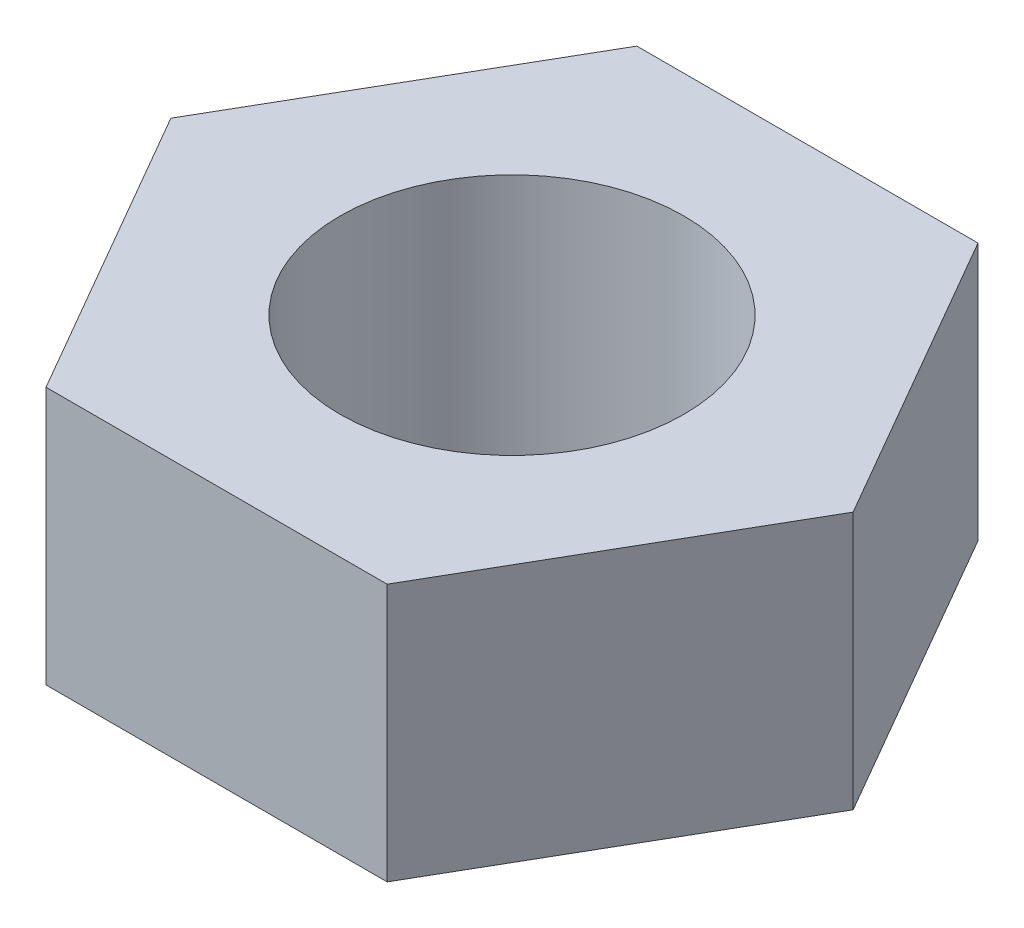
from build123d import *

# Parameters (mm, degrees)
BASE_OUTLINE_SKETCH_R = 1.6
BASE_OUTLINE_DEPTH    = 2.4


with BuildPart() as part:
    # Base Outline Sketch → Base Outline (new body)
    with BuildSketch(Plane(origin=(0, 157.5, 0), x_dir=(1, 0, 0), z_dir=(0, 1, 0))):
        Polygon((-54.703938006, -52.75), (-53.116224765, -50), (-54.703938006, -47.25), (-57.879364486, -47.25), (-59.467077727, -50), (-57.879364486, -52.75), align=None)
        with Locations(Location((-56.291651246, -50, 0), (0, 0, 270))):
            Circle(BASE_OUTLINE_SKETCH_R, mode=Mode.SUBTRACT)
    extrude(amount=BASE_OUTLINE_DEPTH)


solid = part.part
